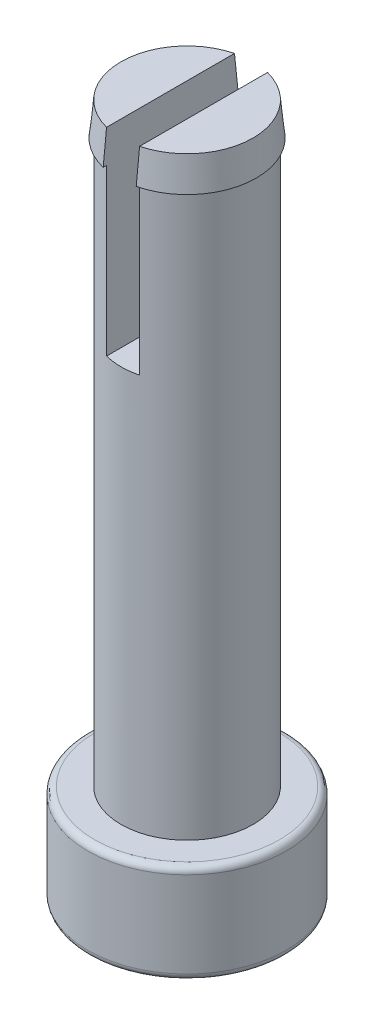
from build123d import *

# Parameters (mm, degrees)
SKETCH_1_R          = 3
EXTRUDE_1_DEPTH     = 3
SKETCH_2_R          = 2
EXTRUDE_2_DEPTH     = 18
SKETCH_4_W          = 1
SKETCH_4_H          = 4.937645572
CUT_EXTRUDE_1_DEPTH = 6
FILLET_1_R          = 0.2


with BuildPart() as part:
    # 草图1 → 凸台-拉伸1 (new body)
    with BuildSketch(Plane(origin=(0, 0, 0), x_dir=(1, 0, 0), z_dir=(0, 1, 0))):
        with Locations(Location((0, 0, 0), (0, 0, 270))):
            Circle(SKETCH_1_R)
    extrude(amount=EXTRUDE_1_DEPTH)

    # 草图2 → 凸台-拉伸2 (add)
    with BuildSketch(Plane(origin=(0, 3, 0), x_dir=(1, 0, 0), z_dir=(0, 1, 0))):
        with Locations(Location((0, 0, 0), (0, 0, 270))):
            Circle(SKETCH_2_R)
    extrude(amount=EXTRUDE_2_DEPTH)

    # 草图3 → 旋转1 (revolve)
    with BuildSketch(Plane.XY, mode=Mode.PRIVATE) as revolve_1_sk:
        Polygon((0, 21), (-2, 21), (-2.1, 20), (0, 20), align=None)
    revolve(revolve_1_sk.sketch.rotate(Axis((0, 20, 0), (0, 1, 0)), 90), axis=Axis((0, 20, 0), (0, 1, 0)))

    # 草图4 → 切除-拉伸1 (cut)
    with BuildSketch(Plane(origin=(0, 21, 0), x_dir=(1, 0, 0), z_dir=(0, 1, 0))):
        Rectangle(SKETCH_4_W, SKETCH_4_H)
    extrude(amount=-CUT_EXTRUDE_1_DEPTH, mode=Mode.SUBTRACT)

    # 圆角1
    fillet_1_edges = [part.edges().sort_by_distance(p)[0] for p in [
        (0, 0, -3),
        (0, 3, -3),
    ]]
    fillet(fillet_1_edges, radius=FILLET_1_R)


solid = part.part
